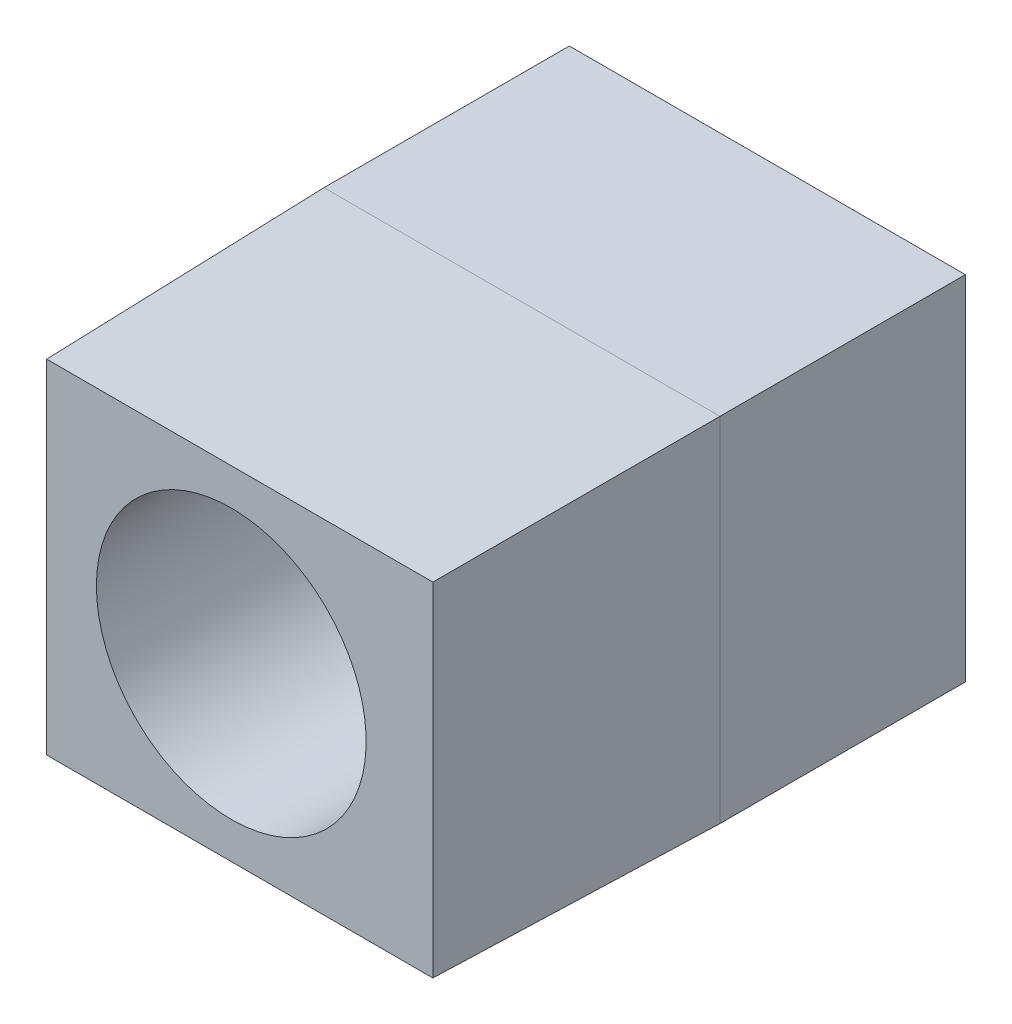
from build123d import *

# Parameters (mm, degrees)
SKETCH1_W                     = 582.097428288
SKETCH1_H                     = 518.453658302
BOSS_EXTRUDE1_DEPTH           = 414.782
BOSS_EXTRUDE1_TAPER           = 1
BOSS_EXTRUDE1_OTHER_WAY_DEPTH = 360.68
SKETCH2_R                     = 198.240238767
CUT_EXTRUDE1_DEPTH            = 868.899312363


with BuildPart() as part:
    # Sketch1 → Boss-Extrude1 (new body)
    with BuildSketch(Plane.XY):
        Rectangle(SKETCH1_W, SKETCH1_H)
    extrude(amount=BOSS_EXTRUDE1_DEPTH, taper=BOSS_EXTRUDE1_TAPER)

    # Sketch1 → Boss-Extrude1 other way (add)
    with BuildSketch(Plane.XY):
        Rectangle(SKETCH1_W, SKETCH1_H)
    extrude(amount=-BOSS_EXTRUDE1_OTHER_WAY_DEPTH)

    # Sketch2 → Cut-Extrude1 (cut, through all)
    with BuildSketch(Plane(origin=(0, 0, -360.68), x_dir=(-1, 0, 0), z_dir=(0, 0, -1))):
        with Locations((12.456248264, 0)):
            Circle(SKETCH2_R)
    extrude(amount=-CUT_EXTRUDE1_DEPTH, mode=Mode.SUBTRACT)


solid = part.part
